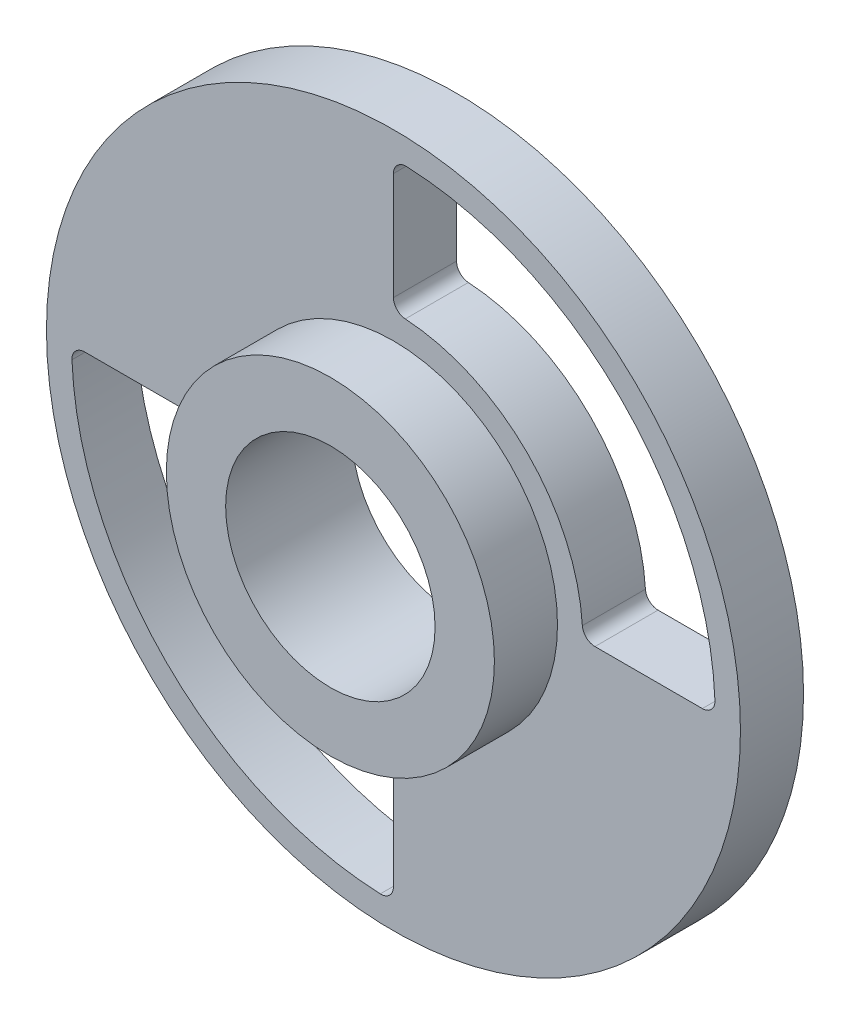
from build123d import *

# Parameters (mm, degrees)
SKETCH1_R                = 13.75
SKETCH1_R_2              = 4.15
BOSS_EXTRUDE1_DEPTH      = 2.5
SKETCH2_R                = 6.5
SKETCH2_R_2              = 4.15
BOSS_EXTRUDE2_DEPTH      = 2.5
CUT_EXTRUDE1_DEPTH       = 21.077973005
FILLET1_R                = 0.5
CIRPATTERN1_COUNT        = 2
FILLET1_OF_CIRPATTERN1_R = 0.5


with BuildPart() as part:
    # Sketch1 → Boss-Extrude1 (new body)
    with BuildSketch(Plane.XY):
        Circle(SKETCH1_R)
        Circle(SKETCH1_R_2, mode=Mode.SUBTRACT)
    extrude(amount=BOSS_EXTRUDE1_DEPTH)

    # Sketch2 → Boss-Extrude2 (add)
    with BuildSketch(Plane.XY.offset(2.5)):
        Circle(SKETCH2_R)
        Circle(SKETCH2_R_2, mode=Mode.SUBTRACT)
    extrude(amount=BOSS_EXTRUDE2_DEPTH)

    # Sketch5 → Cut-Extrude1 (cut, through all)
    with BuildSketch(Plane.XY):
        with BuildLine():
            Line((0, 12.75), (0, 7.5))
            ThreePointArc((0, 7.5), (5.303300859, 5.303300859), (7.5, 0))
            Line((7.5, 0), (12.75, 0))
            ThreePointArc((12.75, 0), (9.01561146, 9.01561146), (0, 12.75))
        make_face()
    cut_extrude1 = extrude(amount=CUT_EXTRUDE1_DEPTH, mode=Mode.SUBTRACT)

    # Fillet1
    fillet1_edges = [part.edges().sort_by_distance(p)[0] for p in [
        (0, 7.5, 1.25),
        (7.5, 0, 1.25),
        (12.75, 0, 1.25),
        (0, 12.75, 1.25),
    ]]
    fillet(fillet1_edges, radius=FILLET1_R)

    # CirPattern1: Cut-Extrude1 ×2 about axis
    cirpattern1_axis = Axis((0, 0, 0), (0, 0, 1))
    for i in range(1, CIRPATTERN1_COUNT):
        add(cut_extrude1.rotate(cirpattern1_axis, i * 360 / CIRPATTERN1_COUNT), mode=Mode.SUBTRACT)

    # Fillet1 of CirPattern1
    fillet1_of_cirpattern1_edges = [part.edges().sort_by_distance(p)[0] for p in [
        (0, -7.5, 1.25),
        (-7.5, 0, 1.25),
        (-12.75, 0, 1.25),
        (0, -12.75, 1.25),
    ]]
    fillet(fillet1_of_cirpattern1_edges, radius=FILLET1_OF_CIRPATTERN1_R)


solid = part.part
